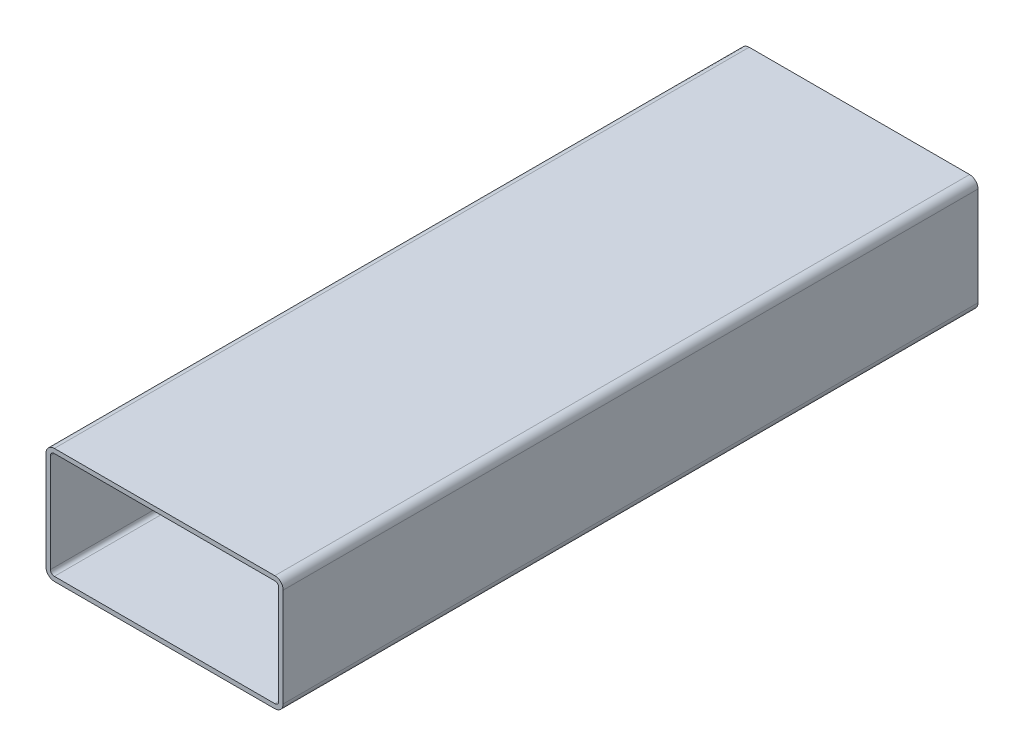
from build123d import *

# Parameters (mm, degrees)
BOSS_EXTRUDE1_DEPTH = 208
SHELL1_T            = -1.33


with BuildPart() as part:
    # Sketch1 → Boss-Extrude1 (new body)
    with BuildSketch(Plane.XY):
        with BuildLine():
            Line((-33, -17.25), (33, -17.25))
            ThreePointArc((33, -17.25), (34.767766953, -16.517766953), (35.5, -14.75))
            Line((35.5, -14.75), (35.5, 14.75))
            ThreePointArc((35.5, 14.75), (34.767766953, 16.517766953), (33, 17.25))
            Line((33, 17.25), (-33, 17.25))
            ThreePointArc((-33, 17.25), (-34.767766953, 16.517766953), (-35.5, 14.75))
            Line((-35.5, 14.75), (-35.5, -14.75))
            ThreePointArc((-35.5, -14.75), (-34.767766953, -16.517766953), (-33, -17.25))
        make_face()
    extrude(amount=-BOSS_EXTRUDE1_DEPTH)

    # Shell1
    shell1_openings = [part.faces().sort_by_distance(p)[0] for p in [
        (0, 0, -208),
        (0, 0, 0),
    ]]
    offset(amount=SHELL1_T, openings=shell1_openings, kind=Kind.INTERSECTION)


solid = part.part
